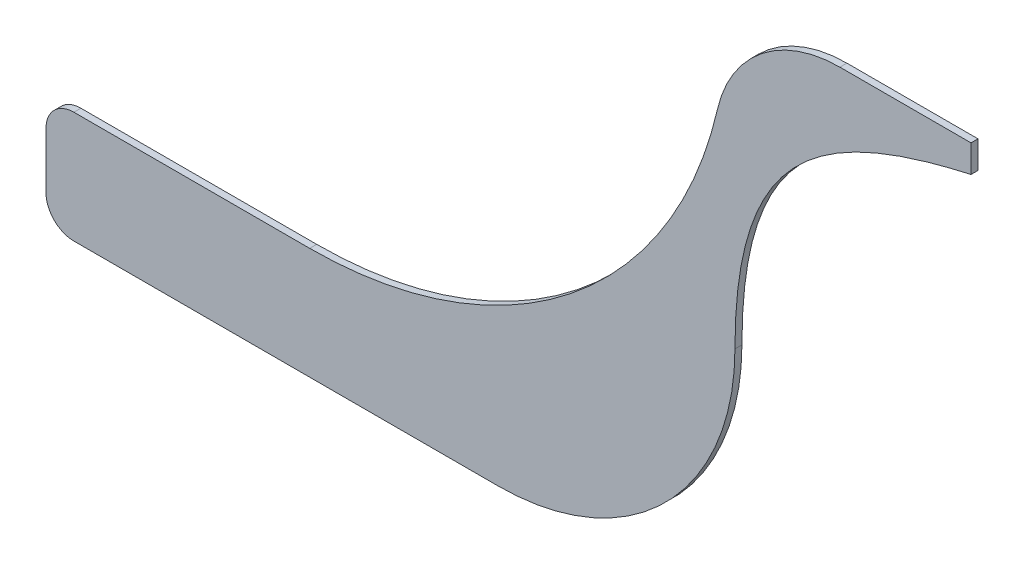
from build123d import *

# Parameters (mm, degrees)
BOSS_EXTRUDE1_DEPTH = 6.35


with BuildPart() as part:
    # Sketch1 → Boss-Extrude1 (new body)
    with BuildSketch(Plane.XY):
        with BuildLine():
            Line((4.79079833, -60.96), (390.725573839, -60.96))
            ThreePointArc((390.725573839, -60.96), (543.389927897, 2.275645942), (606.625573839, 154.94))
            add(Edge.make_bspline(
                [(606.625573839, 154.94), (606.625573839, 316.01001421), (681.985382087, 368.523685091), (821.560436263, 399.924928327)],
                knots=[0, 0, 0, 0, 1, 1, 1, 1], degree=3))
            Line((821.560436263, 399.924928327), (821.560436263, 424.863249898))
            Line((821.560436263, 424.863249898), (702.170074113, 424.863249898))
            ThreePointArc((702.170074113, 424.863249898), (630.985008591, 399.990183462), (590.781410505, 336.196346076))
            ThreePointArc((590.781410505, 336.196346076), (456.769416888, 123.550221456), (219.485865145, 40.64))
            Line((219.485865145, 40.64), (4.79079833, 40.64))
            ThreePointArc((4.79079833, 40.64), (-13.169713912, 33.200512242), (-20.60920167, 15.24))
            Line((-20.60920167, 15.24), (-20.60920167, -35.56))
            ThreePointArc((-20.60920167, -35.56), (-13.169713912, -53.520512242), (4.79079833, -60.96))
        make_face()
    extrude(amount=BOSS_EXTRUDE1_DEPTH)


solid = part.part
